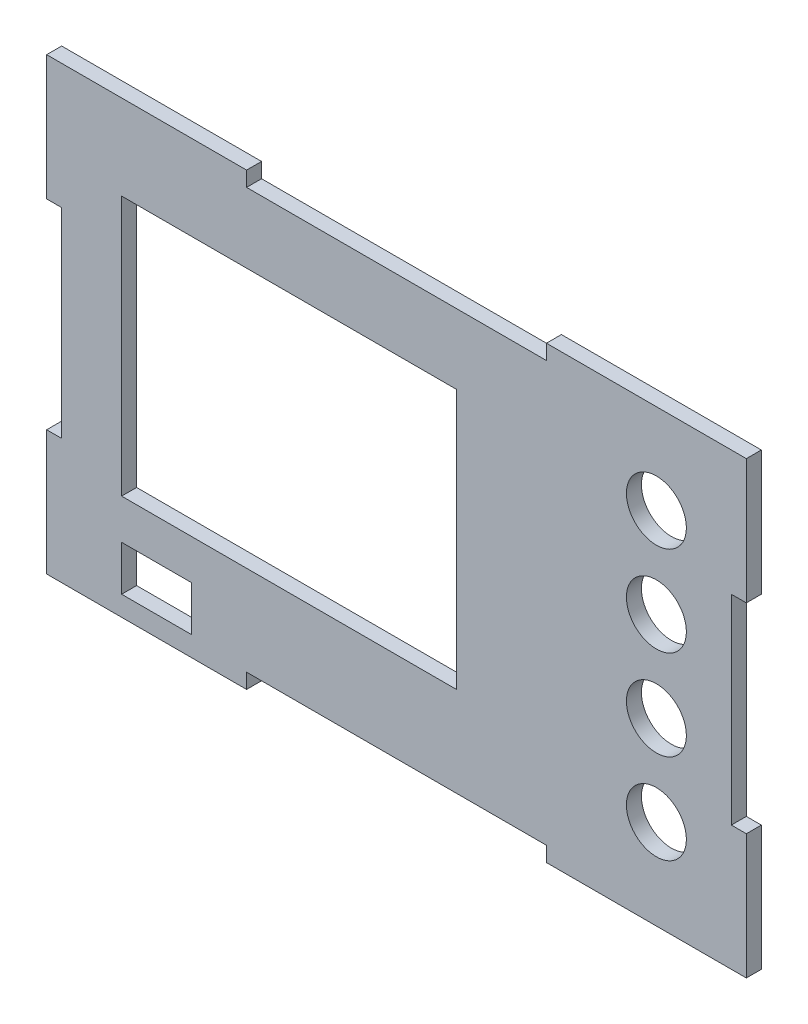
from build123d import *

# Parameters (mm, degrees)
EXTRUDE_1_DEPTH     = 3
SKETCH_2_W          = 14
SKETCH_2_H          = 9
CUT_EXTRUDE_1_DEPTH = 167.460205455
SKETCH_3_W          = 67
SKETCH_3_H          = 52
CUT_EXTRUDE_2_DEPTH = 167.460205455
SKETCH_4_R          = 6
CUT_EXTRUDE_3_DEPTH = 167.460205455


with BuildPart() as part:
    # Эскиз1 → Бобышка-Вытянуть1 (new body)
    with BuildSketch(Plane.XY):
        Polygon((0, 0), (40, 0), (40, 3), (100, 3), (100, 0), (140, 0), (140, 25), (137, 25), (137, 65), (140, 65), (140, 90), (100, 90), (100, 87), (40, 87), (40, 90), (0, 90), (0, 65), (3, 65), (3, 25), (0, 25), align=None)
    extrude(amount=EXTRUDE_1_DEPTH)

    # Эскиз2 → Вырез-Вытянуть1 (cut, through all)
    with BuildSketch(Plane.XY.offset(3)):
        with Locations((22, 8.5)):
            Rectangle(SKETCH_2_W, SKETCH_2_H)
    extrude(amount=-CUT_EXTRUDE_1_DEPTH, mode=Mode.SUBTRACT)

    # Эскиз3 → Вырез-Вытянуть2 (cut, through all)
    with BuildSketch(Plane.XY.offset(3)):
        with Locations((48.5, 47)):
            Rectangle(SKETCH_3_W, SKETCH_3_H)
    extrude(amount=-CUT_EXTRUDE_2_DEPTH, mode=Mode.SUBTRACT)

    # Эскиз4 → Вырез-Вытянуть3 (cut, through all)
    with BuildSketch(Plane.XY.offset(3)):
        with Locations((122, 72)):
            Circle(SKETCH_4_R)
        with Locations((122, 54)):
            Circle(SKETCH_4_R)
        with Locations((122, 36)):
            Circle(SKETCH_4_R)
        with Locations((122, 18)):
            Circle(SKETCH_4_R)
    extrude(amount=-CUT_EXTRUDE_3_DEPTH, mode=Mode.SUBTRACT)


solid = part.part
